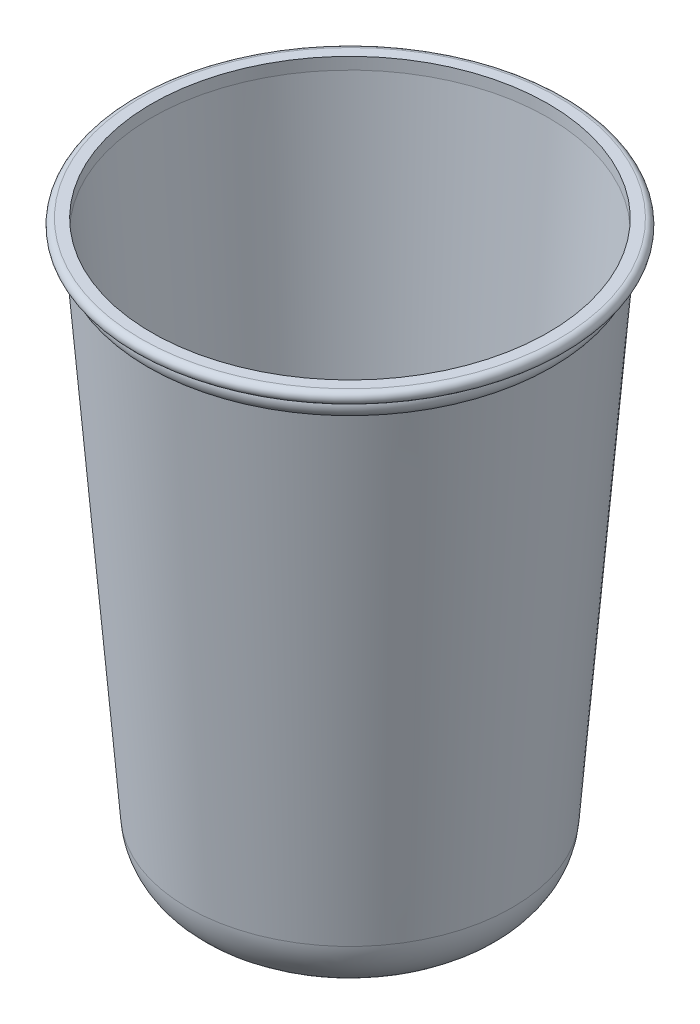
from build123d import *

# Parameters (mm, degrees)
SKETCH2_R          = 16.5
CUT_EXTRUDE1_DEPTH = 5
FILLET1_R          = 2
FILLET2_R          = 1


with BuildPart() as part:
    # Sketch1 → Revolve1 (revolve)
    with BuildSketch(Plane.XY, mode=Mode.PRIVATE) as revolve1_sk:
        with BuildLine():
            Line((0, 120), (43.75, 120))
            ThreePointArc((43.75, 120), (45, 118.75), (43.75, 117.5))
            Line((43.75, 117.5), (42.396051731, 117.5))
            ThreePointArc((42.396051731, 117.5), (42.992044851, 115.67130681), (42.11301593, 113.96056582))
            Line((42.11301593, 113.96056582), (33.956697573, 11.963744782))
            ThreePointArc((33.956697573, 11.963744782), (29.816473561, 3.448264089), (20.998064346, 0))
            Line((20.998064346, 0), (0, 0))
            Line((0, 0), (0, 120))
        make_face()
    revolve(revolve1_sk.sketch.rotate(Axis((0, 120, 0), (0, -1, 0)), 90), axis=Axis((0, 120, 0), (0, -1, 0)))

    # Sketch2 → Cut-Extrude1 (cut)
    with BuildSketch(Plane.XZ):
        with Locations(Location((0, 0, 0), (0, 0, 270))):
            Circle(SKETCH2_R)
    extrude(amount=-CUT_EXTRUDE1_DEPTH, mode=Mode.SUBTRACT)

    # Fillet1
    fillet1_edges = [part.edges().sort_by_distance(p)[0] for p in [
        (0, 0, 16.5),
    ]]
    fillet(fillet1_edges, radius=FILLET1_R)

    # Fillet2
    fillet2_edges = [part.edges().sort_by_distance(p)[0] for p in [
        (0, 5, 16.5),
    ]]
    fillet(fillet2_edges, radius=FILLET2_R)

    # Sketch4 → Cut-Revolve1 (revolve, cut)
    with BuildSketch(Plane(origin=(0, 0, 0), x_dir=(0, 0, -1), z_dir=(1, 0, 0))):
        with BuildLine():
            Line((0, 6.173075097), (0, 120))
            Line((0, 120), (41.5, 120))
            Line((41.5, 120), (41.5, 117.5))
            Line((41.5, 117.5), (33.060645842, 11.963744782))
            ThreePointArc((33.060645842, 11.963744782), (28.139602956, 3.223593528), (18.316870923, 1.193607704))
            ThreePointArc((18.316870923, 1.193607704), (17.853765217, 1.484068415), (17.673075097, 2))
            Line((17.673075097, 2), (17.673075097, 4))
            ThreePointArc((17.673075097, 4), (17.036596137, 5.536596137), (15.5, 6.173075097))
            Line((15.5, 6.173075097), (0, 6.173075097))
        make_face()
    revolve(axis=Axis((0, 6.173075097, 0), (0, 1, 0)), mode=Mode.SUBTRACT)


solid = part.part
